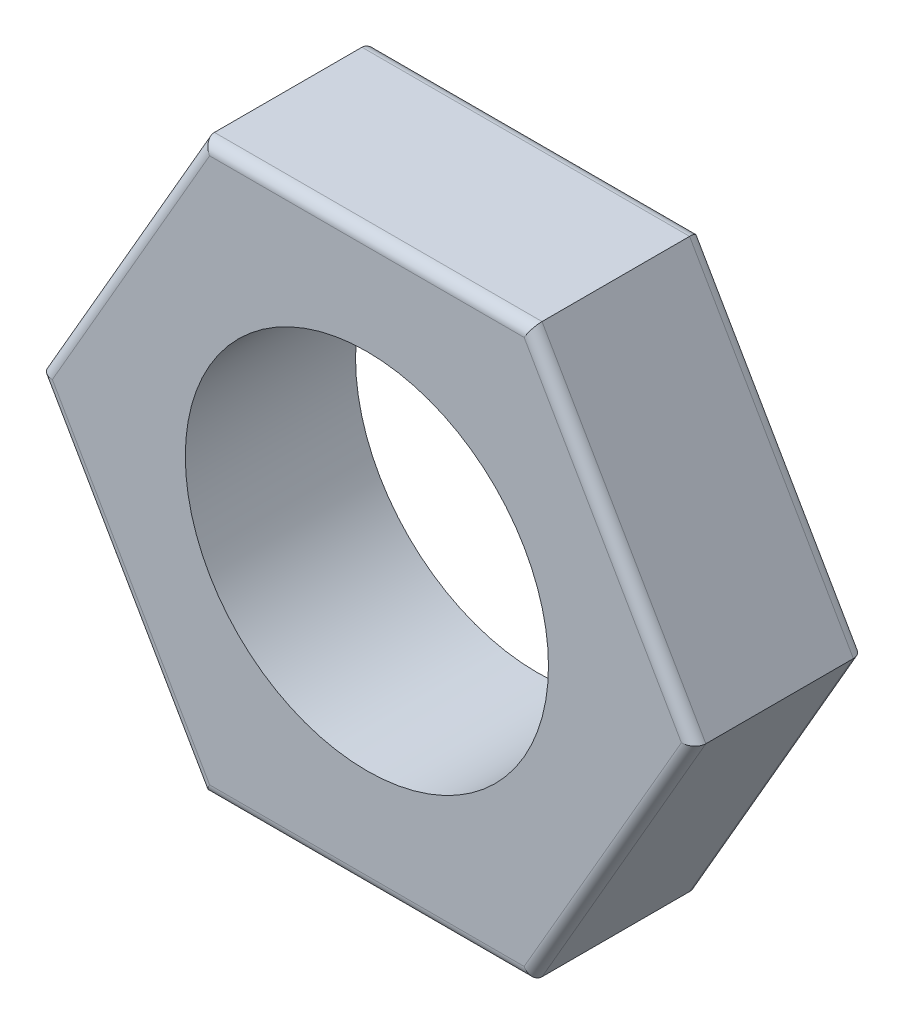
from build123d import *

# Parameters (mm, degrees)
EXTRUDE_1_DEPTH     = 7.5
SKETCH_3_R          = 8
CUT_EXTRUDE_1_DEPTH = 21.514222708
FILLET_1_R          = 0.5


with BuildPart() as part:
    # 草图2 → 凸台-拉伸1 (new body)
    with BuildSketch(Plane.XY):
        Polygon((7.216878365, -12.5), (14.43375673, 0), (7.216878365, 12.5), (-7.216878365, 12.5), (-14.43375673, 0), (-7.216878365, -12.5), align=None)
    extrude(amount=EXTRUDE_1_DEPTH)

    # 草图3 → 切除-拉伸1 (cut, through all)
    with BuildSketch(Plane.XY.offset(7.5)):
        Circle(SKETCH_3_R)
    extrude(amount=-CUT_EXTRUDE_1_DEPTH, mode=Mode.SUBTRACT)

    # 圆角1
    fillet_1_edges = [part.edges().sort_by_distance(p)[0] for p in [
        (10.825317547, 6.25, 7.5),
        (0, 12.5, 7.5),
        (-10.825317547, 6.25, 7.5),
        (-10.825317547, -6.25, 7.5),
        (0, -12.5, 7.5),
        (-10.825317547, -6.25, 0),
        (-10.825317547, 6.25, 0),
        (0, 12.5, 0),
        (10.825317547, -6.25, 7.5),
        (10.825317547, 6.25, 0),
        (10.825317547, -6.25, 0),
        (0, -12.5, 0),
    ]]
    fillet(fillet_1_edges, radius=FILLET_1_R)


solid = part.part
